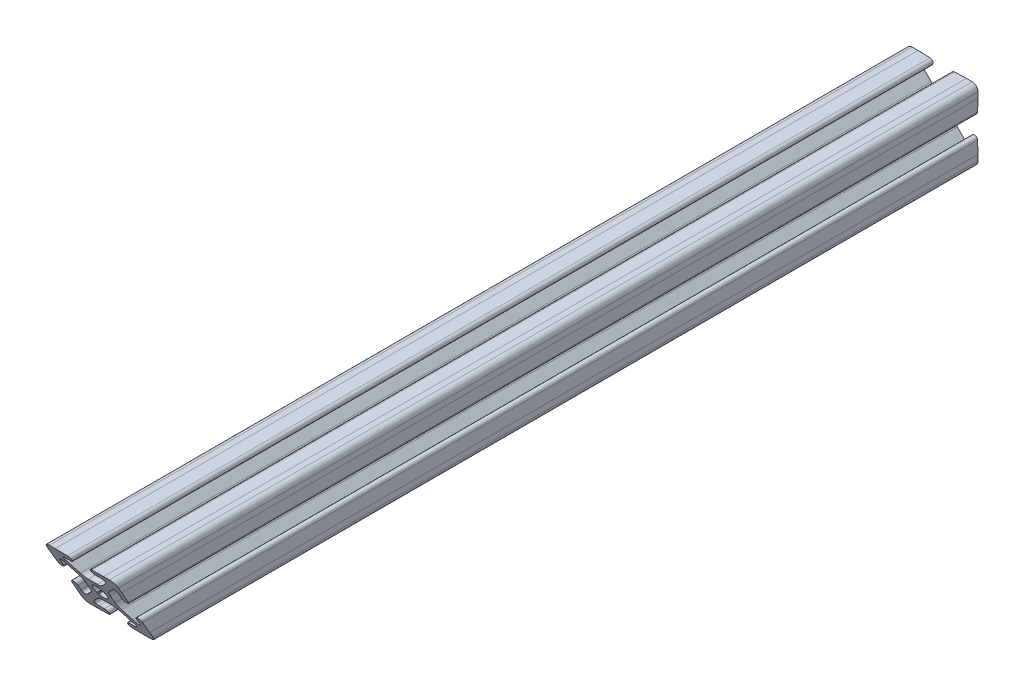
from build123d import *

# Parameters (mm, degrees)
BOSS_EXTRUDE1_DEPTH = 301.5996
CUT_EXTRUDE1_DEPTH  = 322.293063297


with BuildPart() as part:
    # Model → Boss-Extrude1 (new body)
    with BuildSketch(Plane.XY):
        with BuildLine():
            Line((50.659960212, 72.999871414), (53.774553856, 72.999871414))
            ThreePointArc((53.774553856, 72.999871414), (54.989573754, 72.758188929), (56.019617887, 72.069935444))
            Line((56.019617887, 72.069935444), (59.264200891, 68.825352439))
            ThreePointArc((59.264200891, 68.825352439), (59.477513437, 67.701802895), (58.510322513, 67.091550869))
            Line((58.510322513, 67.091550869), (56.572487817, 67.159221548))
            ThreePointArc((56.572487817, 67.159221548), (55.4691069, 66.130302197), (56.498026251, 65.026921279))
            Line((56.498026251, 65.026921279), (60.677257034, 64.880979325))
            Line((60.677257034, 64.880979325), (62.710657034, 64.880979325))
            ThreePointArc((62.710657034, 64.880979325), (64.129537501, 65.468698857), (64.717257034, 66.887579325))
            Line((64.717257034, 66.887579325), (64.717257034, 68.920979325))
            Line((64.717257034, 68.920979325), (64.57131508, 73.100210108))
            ThreePointArc((64.57131508, 73.100210108), (63.467934162, 74.129129459), (62.439014811, 73.025748542))
            Line((62.439014811, 73.025748542), (62.50668549, 71.087913846))
            ThreePointArc((62.50668549, 71.087913846), (61.896433464, 70.120722922), (60.77288392, 70.334035468))
            Line((60.77288392, 70.334035468), (57.528300915, 73.578618472))
            ThreePointArc((57.528300915, 73.578618472), (56.84004743, 74.608662605), (56.598364945, 75.823682503))
            Line((56.598364945, 75.823682503), (56.598364945, 78.938276147))
            ThreePointArc((56.598364945, 78.938276147), (56.84004743, 80.153296044), (57.528300915, 81.183340177))
            Line((57.528300915, 81.183340177), (60.77288392, 84.427923182))
            ThreePointArc((60.77288392, 84.427923182), (61.896433464, 84.641235728), (62.50668549, 83.674044803))
            Line((62.50668549, 83.674044803), (62.439014811, 81.736210108))
            ThreePointArc((62.439014811, 81.736210108), (63.467934162, 80.63282919), (64.57131508, 81.661748542))
            Line((64.57131508, 81.661748542), (64.717257034, 85.840979325))
            Line((64.717257034, 85.840979325), (64.717257034, 87.874379325))
            ThreePointArc((64.717257034, 87.874379325), (64.129537501, 89.293259792), (62.710657034, 89.880979325))
            Line((62.710657034, 89.880979325), (60.677257034, 89.880979325))
            Line((60.677257034, 89.880979325), (56.498026251, 89.73503737))
            ThreePointArc((56.498026251, 89.73503737), (55.4691069, 88.631656452), (56.572487817, 87.602737101))
            Line((56.572487817, 87.602737101), (58.510322513, 87.67040778))
            ThreePointArc((58.510322513, 87.67040778), (59.477513437, 87.060155754), (59.264200891, 85.93660621))
            Line((59.264200891, 85.93660621), (56.019617887, 82.692023205))
            ThreePointArc((56.019617887, 82.692023205), (54.989573754, 82.00376972), (53.774553856, 81.762087236))
            Line((53.774553856, 81.762087236), (50.659960212, 81.762087236))
            ThreePointArc((50.659960212, 81.762087236), (49.444940315, 82.00376972), (48.414896182, 82.692023205))
            Line((48.414896182, 82.692023205), (45.170313177, 85.93660621))
            ThreePointArc((45.170313177, 85.93660621), (44.957000631, 87.060155754), (45.924191556, 87.67040778))
            Line((45.924191556, 87.67040778), (47.862026251, 87.602737101))
            ThreePointArc((47.862026251, 87.602737101), (48.965407169, 88.631656452), (47.936487817, 89.73503737))
            Line((47.936487817, 89.73503737), (43.757257034, 89.880979325))
            Line((43.757257034, 89.880979325), (41.723857034, 89.880979325))
            ThreePointArc((41.723857034, 89.880979325), (40.304976567, 89.293259792), (39.717257034, 87.874379325))
            Line((39.717257034, 87.874379325), (39.717257034, 85.840979325))
            Line((39.717257034, 85.840979325), (39.863198989, 81.661748542))
            ThreePointArc((39.863198989, 81.661748542), (40.966579907, 80.63282919), (41.995499258, 81.736210108))
            Line((41.995499258, 81.736210108), (41.927828579, 83.674044803))
            ThreePointArc((41.927828579, 83.674044803), (42.538080605, 84.641235728), (43.661630149, 84.427923182))
            Line((43.661630149, 84.427923182), (46.906213154, 81.183340177))
            ThreePointArc((46.906213154, 81.183340177), (47.594466639, 80.153296044), (47.836149123, 78.938276147))
            Line((47.836149123, 78.938276147), (47.836149123, 75.823682503))
            ThreePointArc((47.836149123, 75.823682503), (47.594466639, 74.608662605), (46.906213154, 73.578618472))
            Line((46.906213154, 73.578618472), (43.661630149, 70.334035468))
            ThreePointArc((43.661630149, 70.334035468), (42.538080605, 70.120722922), (41.927828579, 71.087913846))
            Line((41.927828579, 71.087913846), (41.995499258, 73.025748542))
            ThreePointArc((41.995499258, 73.025748542), (40.966579907, 74.129129459), (39.863198989, 73.100210108))
            Line((39.863198989, 73.100210108), (39.717257034, 68.920979325))
            Line((39.717257034, 68.920979325), (39.717257034, 66.887579325))
            ThreePointArc((39.717257034, 66.887579325), (40.304976567, 65.468698857), (41.723857034, 64.880979325))
            Line((41.723857034, 64.880979325), (43.757257034, 64.880979325))
            Line((43.757257034, 64.880979325), (47.936487817, 65.026921279))
            ThreePointArc((47.936487817, 65.026921279), (48.965407169, 66.130302197), (47.862026251, 67.159221548))
            Line((47.862026251, 67.159221548), (45.924191556, 67.091550869))
            ThreePointArc((45.924191556, 67.091550869), (44.957000631, 67.701802895), (45.170313177, 68.825352439))
            Line((45.170313177, 68.825352439), (48.414896182, 72.069935444))
            ThreePointArc((48.414896182, 72.069935444), (49.444940315, 72.758188929), (50.659960212, 72.999871414))
        make_face()
        with BuildLine():
            Line((50.64953831, 75.433607249), (50.269884959, 75.433607249))
            Line((50.269884959, 75.433607249), (50.269884959, 75.8132606))
            ThreePointArc((50.269884959, 75.8132606), (53.985023987, 79.148746278), (50.64953831, 75.433607249))
        make_face(mode=Mode.SUBTRACT)
    extrude(amount=BOSS_EXTRUDE1_DEPTH)

    # Sketch2 → Cut-Extrude1 (cut, through all)
    with BuildSketch(Plane(origin=(0, 0, 0), x_dir=(0, 0, -1), z_dir=(1, 0, 0))):
        Polygon((-301.5996, 64.880979325), (-301.5996, 89.880979325), (-287.16584327, 64.880979325), align=None)
    extrude(amount=CUT_EXTRUDE1_DEPTH, mode=Mode.SUBTRACT)


solid = part.part
